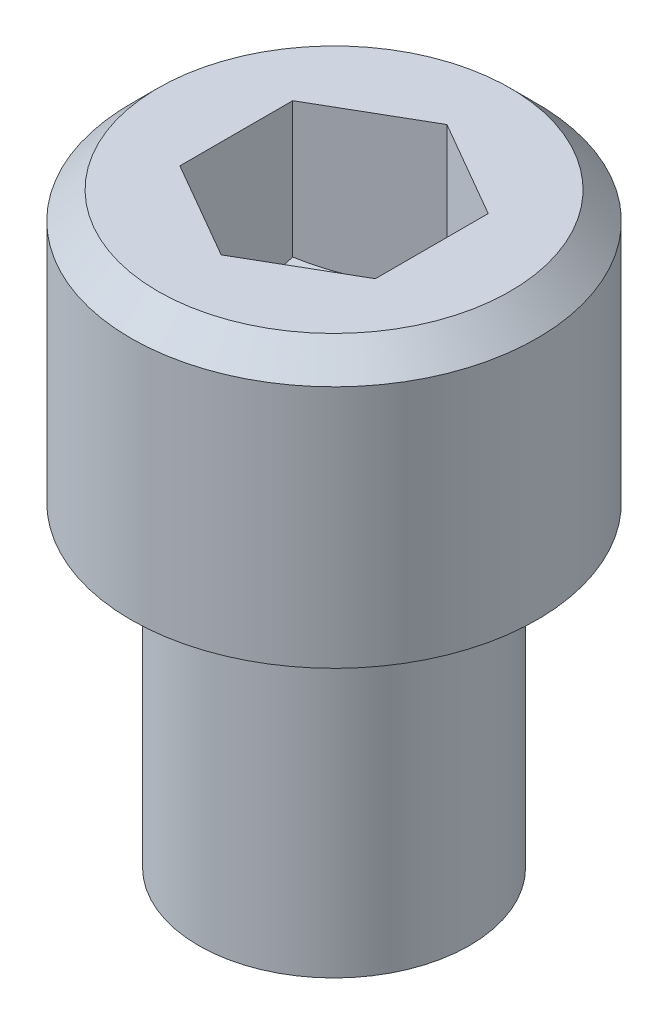
from build123d import *

# Parameters (mm, degrees)
CROQUIS4_R              = 9
SALIENTE_EXTRUIR3_DEPTH = 12
CHAFL_N2_SIZE           = 1.2
CROQUIS6_7_R            = 6
SALIENTE_EXTRUIR9_DEPTH = 14


with BuildPart() as part:
    # Croquis4 → Saliente-Extruir3 (new body)
    with BuildSketch(Plane(origin=(0, 0, 0), x_dir=(1, 0, 0), z_dir=(0, 1, 0))):
        Circle(CROQUIS4_R)
        Polygon((0, 5), (-4.330127019, 2.5), (-4.330127019, -2.5), (0, -5), (4.330127019, -2.5), (4.330127019, 2.5), align=None, mode=Mode.SUBTRACT)
    extrude(amount=SALIENTE_EXTRUIR3_DEPTH)

    # Chaflán2
    chafl_n2_edges = [part.edges().sort_by_distance(p)[0] for p in [
        (-9, 12, 0),
    ]]
    chamfer(chafl_n2_edges, length=CHAFL_N2_SIZE)

    # Croquis5 → Revolución2 (revolve)
    with BuildSketch(Plane.XY):
        Polygon((0, 0), (0, 3.113248654), (5, 6), (9, 6), (9, 0), align=None)
    revolve(axis=Axis((0, 0, 0), (0, 1, 0)))

    # Croquis6<7> → Saliente-Extruir9 (add)
    with BuildSketch(Plane.XZ):
        Circle(CROQUIS6_7_R)
    extrude(amount=SALIENTE_EXTRUIR9_DEPTH)


solid = part.part
